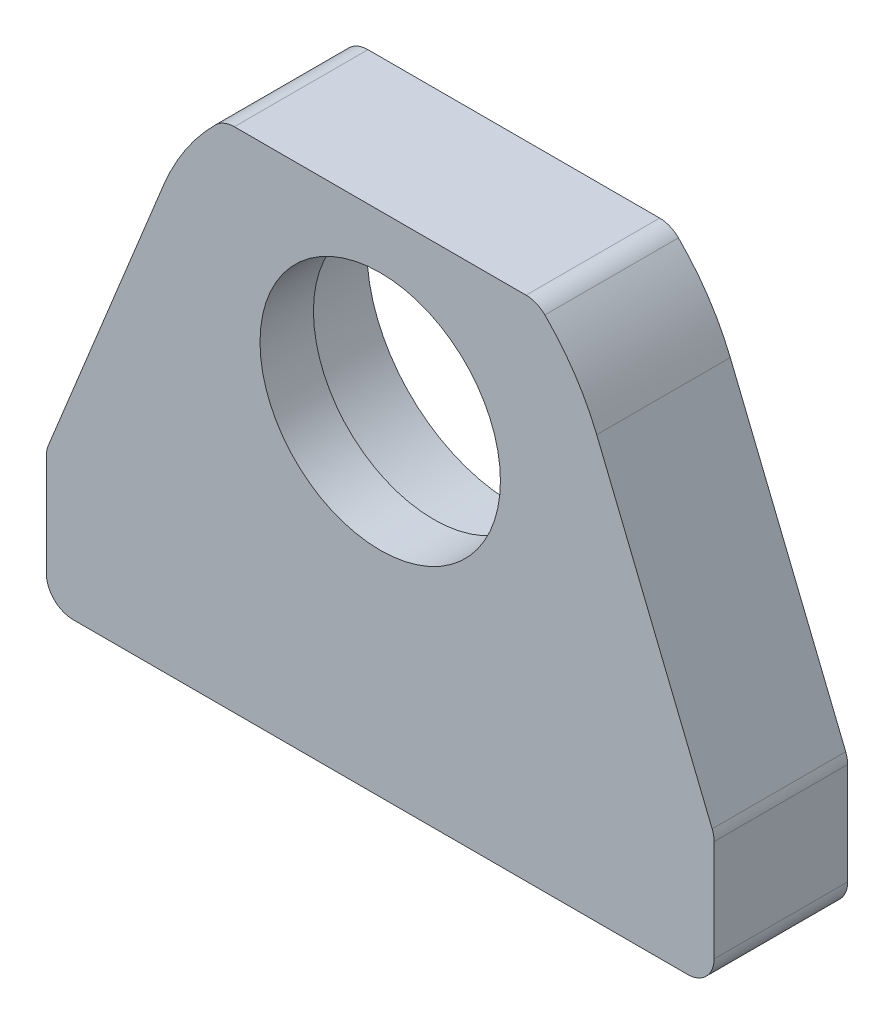
from build123d import *

# Parameters (mm, degrees)
EXTRUDE_1_DEPTH     = 10
SKETCH_2_R          = 11
CUT_EXTRUDE_1_DEPTH = 6
SKETCH_3_R          = 1.65
CUT_EXTRUDE_2_DEPTH = 10
SKETCH_4_R          = 9
CUT_EXTRUDE_3_DEPTH = 36.860842154
FILLET_1_R          = 2


with BuildPart() as part:
    # ｽｹｯﾁ1 → ﾎﾞｽ - 押し出し1 (new body)
    with BuildSketch(Plane.XY):
        with BuildLine():
            Line((-25, -15), (-16.20863824, 6.597730399))
            ThreePointArc((-16.20863824, 6.597730399), (-14.32427611, 10.053114638), (-11.715374514, 13))
            Line((-11.715374514, 13), (11.715374514, 13))
            ThreePointArc((11.715374514, 13), (14.32427611, 10.053114638), (16.20863824, 6.597730399))
            Line((16.20863824, 6.597730399), (25, -15))
            Line((25, -15), (25, -25))
            Line((25, -25), (-25, -25))
            Line((-25, -25), (-25, -15))
        make_face()
    extrude(amount=EXTRUDE_1_DEPTH)

    # ｽｹｯﾁ2 → ｶｯﾄ - 押し出し1 (cut)
    with BuildSketch(Plane(origin=(0, 0, 0), x_dir=(-1, 0, 0), z_dir=(0, 0, -1))):
        Circle(SKETCH_2_R)
    extrude(amount=-CUT_EXTRUDE_1_DEPTH, mode=Mode.SUBTRACT)

    # ｽｹｯﾁ3 → ｶｯﾄ - 押し出し2 (cut)
    with BuildSketch(Plane.XZ.offset(25)):
        with Locations((-20, 5)):
            Circle(SKETCH_3_R)
        with Locations(Location((20, 5, 0), (0, 0, 180))):
            Circle(SKETCH_3_R)
    extrude(amount=-CUT_EXTRUDE_2_DEPTH, mode=Mode.SUBTRACT)

    # ｽｹｯﾁ4 → ｶｯﾄ - 押し出し3 (cut, through all)
    with BuildSketch(Plane(origin=(0, 0, 6), x_dir=(-1, 0, 0), z_dir=(0, 0, -1))):
        Circle(SKETCH_4_R)
    extrude(amount=-CUT_EXTRUDE_3_DEPTH, mode=Mode.SUBTRACT)

    # ﾌｨﾚｯﾄ1
    fillet_1_edges = [part.edges().sort_by_distance(p)[0] for p in [
        (25, -25, 5),
        (-25, -25, 5),
        (-25, -15, 5),
        (-11.715374514, 13, 5),
        (11.715374514, 13, 5),
        (25, -15, 5),
    ]]
    fillet(fillet_1_edges, radius=FILLET_1_R)


solid = part.part
